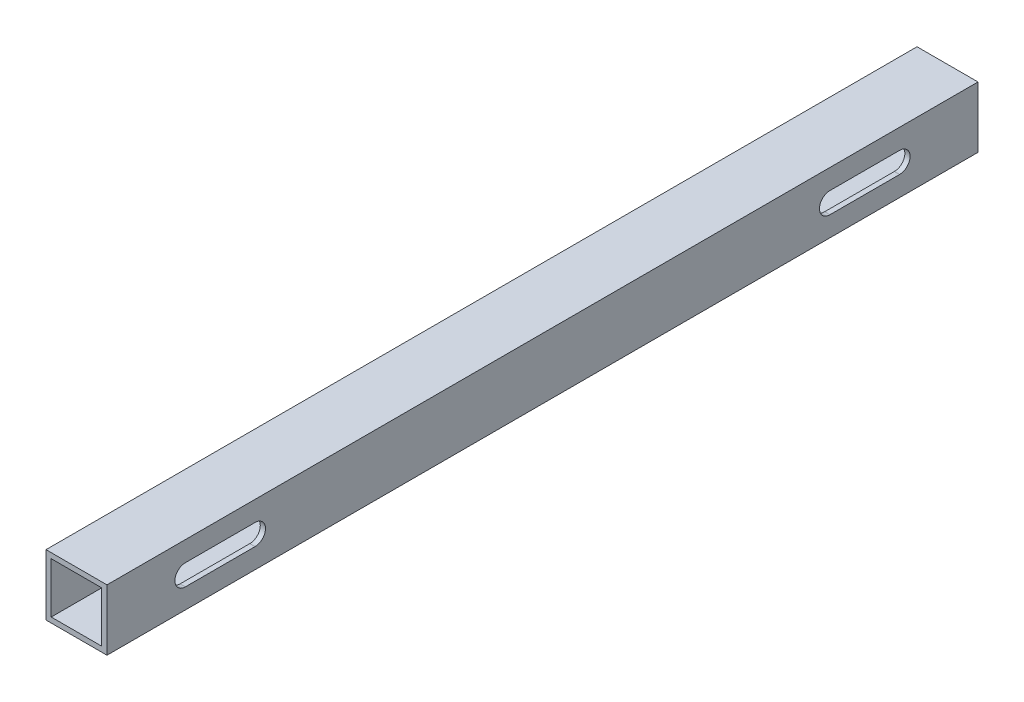
from build123d import *

# Parameters (mm, degrees)
SZKIC1_W                    = 35
SZKIC1_H                    = 35
SZKIC1_W_2                  = 29
SZKIC1_H_2                  = 29
DODANIE_WYCI_GNI_CIE1_DEPTH = 500
WYTNIJ_WYCI_GNI_CIE1_REACH  = 503.529


with BuildPart() as part:
    # Szkic1 → Dodanie-wyciągnięcie1 (new body)
    with BuildSketch(Plane.XY):
        Rectangle(SZKIC1_W, SZKIC1_H)
        Rectangle(SZKIC1_W_2, SZKIC1_H_2, mode=Mode.SUBTRACT)
    extrude(amount=DODANIE_WYCI_GNI_CIE1_DEPTH)

    # Wytnij-wyciągnięcie1: up to this face of the body (flat: up to its plane)
    wytnij_wyci_gni_cie1_end = Plane(part.part.faces().sort_by_distance((-17.5, 0, 250))[0])
    # Szkic2 → Wytnij-wyciągnięcie1 (cut, up to the picked face)
    with BuildSketch(Plane(origin=(17.5, 0, 0), x_dir=(0, 0, -1), z_dir=(1, 0, 0)), mode=Mode.PRIVATE) as wytnij_wyci_gni_cie1_sk1:
        with BuildLine():
            Line((-455, 6), (-415, 6))
            ThreePointArc((-415, 6), (-409, 0), (-415, -6))
            Line((-415, -6), (-455, -6))
            ThreePointArc((-455, -6), (-461, 0), (-455, 6))
        make_face()
    wytnij_wyci_gni_cie1_tool1 = split(extrude(wytnij_wyci_gni_cie1_sk1.sketch, amount=-WYTNIJ_WYCI_GNI_CIE1_REACH, mode=Mode.PRIVATE), bisect_by=wytnij_wyci_gni_cie1_end, keep=Keep.BOTH, mode=Mode.PRIVATE)
    # Szkic2 → Wytnij-wyciągnięcie1 (cut, up to the picked face)
    with BuildSketch(Plane(origin=(17.5, 0, 0), x_dir=(0, 0, -1), z_dir=(1, 0, 0)), mode=Mode.PRIVATE) as wytnij_wyci_gni_cie1_sk2:
        with BuildLine():
            Line((-45, -6), (-85, -6))
            ThreePointArc((-85, -6), (-91, 0), (-85, 6))
            Line((-85, 6), (-45, 6))
            ThreePointArc((-45, 6), (-39, 0), (-45, -6))
        make_face()
    wytnij_wyci_gni_cie1_tool2 = split(extrude(wytnij_wyci_gni_cie1_sk2.sketch, amount=-WYTNIJ_WYCI_GNI_CIE1_REACH, mode=Mode.PRIVATE), bisect_by=wytnij_wyci_gni_cie1_end, keep=Keep.BOTH, mode=Mode.PRIVATE)
    add(wytnij_wyci_gni_cie1_tool1.solids().sort_by(Axis((17.5, 0, 435), (-1, 0, 0)))[0], mode=Mode.SUBTRACT)
    add(wytnij_wyci_gni_cie1_tool2.solids().sort_by(Axis((17.5, 0, 65), (-1, 0, 0)))[0], mode=Mode.SUBTRACT)


solid = part.part
